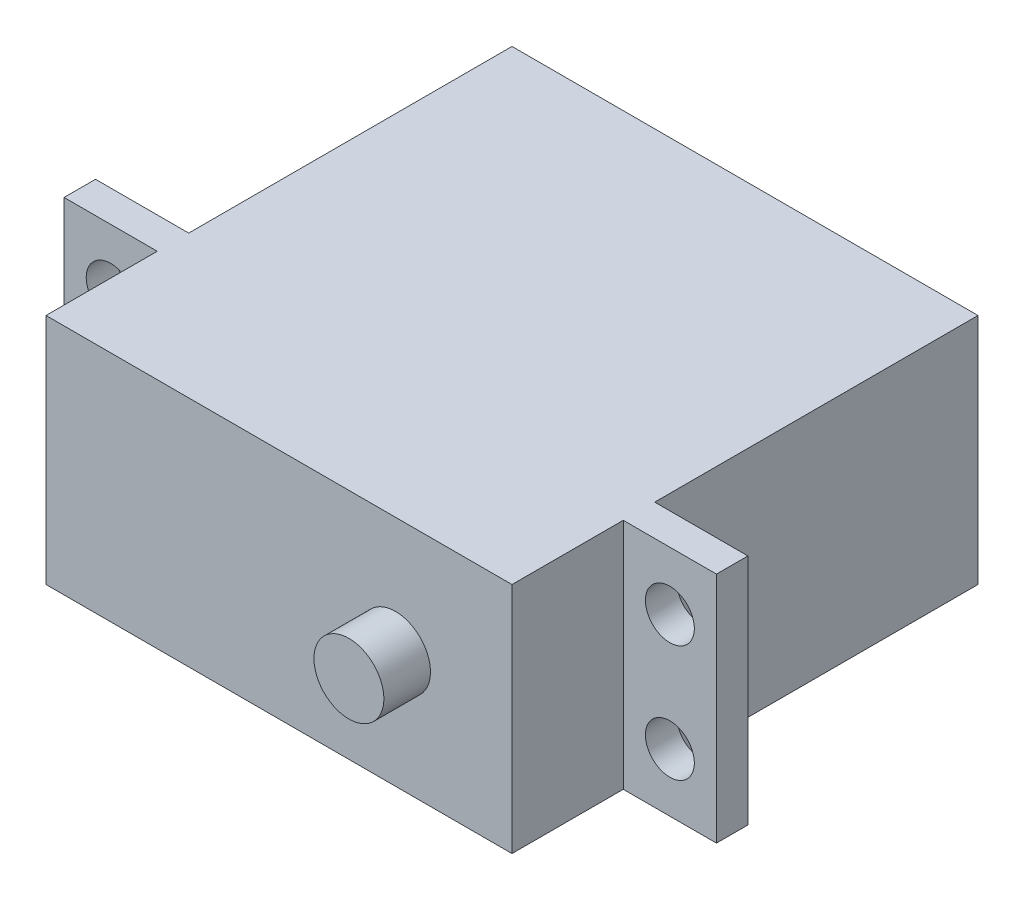
from build123d import *

# Parameters (mm, degrees)
SKETCH1_W           = 40
SKETCH1_H           = 20
BOSS_EXTRUDE1_DEPTH = 40
BOSS_EXTRUDE2_START = 40
SKETCH2_R           = 3
BOSS_EXTRUDE2_DEPTH = 4
BOSS_EXTRUDE3_START = 27.75
SKETCH3_W           = 56
SKETCH3_H           = 20
SKETCH3_R           = 2.1
BOSS_EXTRUDE3_DEPTH = 2.7


with BuildPart() as part:
    # Sketch1 → Boss-Extrude1 (new body)
    with BuildSketch(Plane.XY):
        Rectangle(SKETCH1_W, SKETCH1_H)
    extrude(amount=BOSS_EXTRUDE1_DEPTH)

    # Sketch2 → Boss-Extrude2 (add)
    with BuildSketch(Plane.XY.offset(BOSS_EXTRUDE2_START)):
        with Locations(Location((10, 0, 0), (0, 0, 180))):
            Circle(SKETCH2_R)
    extrude(amount=BOSS_EXTRUDE2_DEPTH)

    # Sketch3 → Boss-Extrude3 (add)
    with BuildSketch(Plane.XY.offset(BOSS_EXTRUDE3_START)):
        Rectangle(SKETCH3_W, SKETCH3_H)
        with Locations(Location((-24, 5, 0), (0, 0, 180))):
            Circle(SKETCH3_R, mode=Mode.SUBTRACT)
        with Locations(Location((-24, -5, 0), (0, 0, 180))):
            Circle(SKETCH3_R, mode=Mode.SUBTRACT)
        with Locations(Location((24, -5, 0), (0, 0, 180))):
            Circle(SKETCH3_R, mode=Mode.SUBTRACT)
        with Locations(Location((24, 5, 0), (0, 0, 180))):
            Circle(SKETCH3_R, mode=Mode.SUBTRACT)
    extrude(amount=BOSS_EXTRUDE3_DEPTH)


solid = part.part
